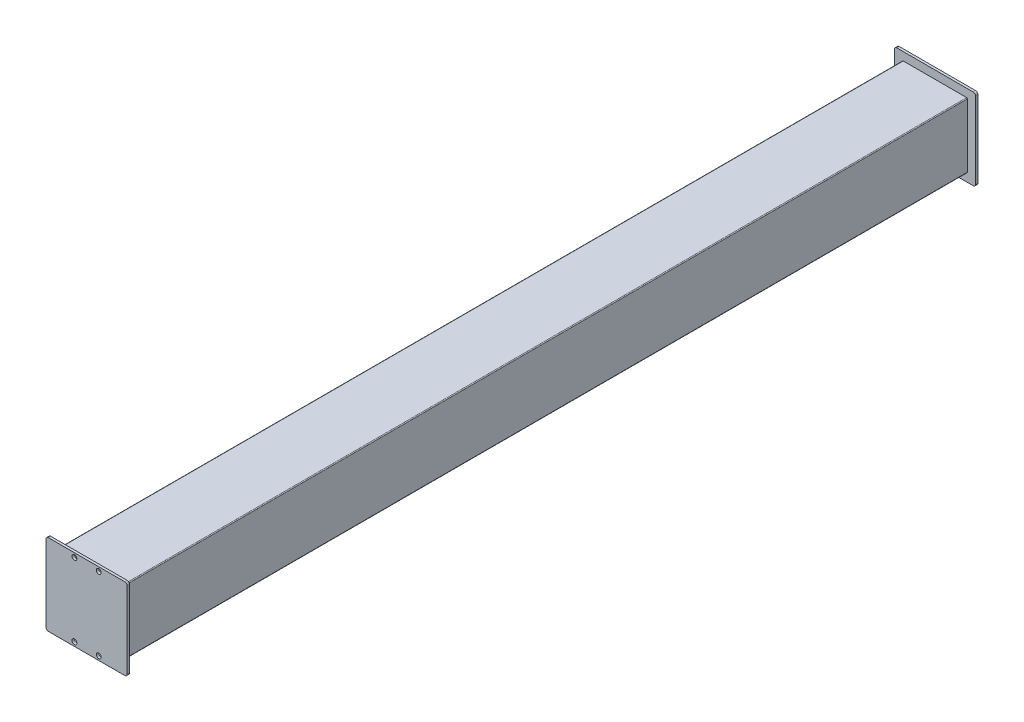
from build123d import *

# Parameters (mm, degrees)
SKETCH2_W           = 80
SKETCH2_H           = 80
SKETCH2_W_2         = 72.8
SKETCH2_H_2         = 72.8
BOSS_EXTRUDE1_DEPTH = 1042
FILLET1_R           = 1
FILLET2_R           = 1
SKETCH3_W           = 100
SKETCH3_H           = 100
BOSS_EXTRUDE2_DEPTH = 3
FILLET3_R           = 3
SKETCH5_R           = 3
CUT_EXTRUDE1_DEPTH  = 3
SKETCH6_W           = 100
SKETCH6_H           = 100
BOSS_EXTRUDE3_DEPTH = 3
FILLET4_R           = 3


with BuildPart() as part:
    # Sketch2 → Boss-Extrude1 (new body)
    with BuildSketch(Plane.XY):
        Rectangle(SKETCH2_W, SKETCH2_H)
        Rectangle(SKETCH2_W_2, SKETCH2_H_2, mode=Mode.SUBTRACT)
    extrude(amount=BOSS_EXTRUDE1_DEPTH)

    # Fillet1
    fillet1_edges = [part.edges().sort_by_distance(p)[0] for p in [
        (40, -40, 521),
        (-40, -40, 521),
        (-40, 40, 521),
        (40, 40, 521),
    ]]
    fillet(fillet1_edges, radius=FILLET1_R)

    # Fillet2
    fillet2_edges = [part.edges().sort_by_distance(p)[0] for p in [
        (-36.4, 36.4, 521),
        (-36.4, -36.4, 521),
        (36.4, -36.4, 521),
        (36.4, 36.4, 521),
    ]]
    fillet(fillet2_edges, radius=FILLET2_R)

    # Sketch3 → Boss-Extrude2 (add)
    with BuildSketch(Plane.XY.offset(1042)):
        Rectangle(SKETCH3_W, SKETCH3_H)
    extrude(amount=BOSS_EXTRUDE2_DEPTH)

    # Fillet3
    fillet3_edges = [part.edges().sort_by_distance(p)[0] for p in [
        (50, -50, 1043.5),
        (50, 50, 1043.5),
        (-50, 50, 1043.5),
        (-50, -50, 1043.5),
    ]]
    fillet(fillet3_edges, radius=FILLET3_R)

    # Sketch5 → Cut-Extrude1 (cut)
    with BuildSketch(Plane(origin=(0, 0, 1042), x_dir=(-1, 0, 0), z_dir=(0, 0, -1))):
        with Locations((15, -45)):
            Circle(SKETCH5_R)
        with Locations((-15, -45)):
            Circle(SKETCH5_R)
        with Locations((15, 45)):
            Circle(SKETCH5_R)
        with Locations((-15, 45)):
            Circle(SKETCH5_R)
    extrude(amount=-CUT_EXTRUDE1_DEPTH, mode=Mode.SUBTRACT)

    # Sketch6 → Boss-Extrude3 (add)
    with BuildSketch(Plane(origin=(0, 0, 0), x_dir=(-1, 0, 0), z_dir=(0, 0, -1))):
        Rectangle(SKETCH6_W, SKETCH6_H)
    extrude(amount=BOSS_EXTRUDE3_DEPTH)

    # Fillet4
    fillet4_edges = [part.edges().sort_by_distance(p)[0] for p in [
        (-50, -50, -1.5),
        (-50, 50, -1.5),
        (50, 50, -1.5),
        (50, -50, -1.5),
    ]]
    fillet(fillet4_edges, radius=FILLET4_R)


solid = part.part
